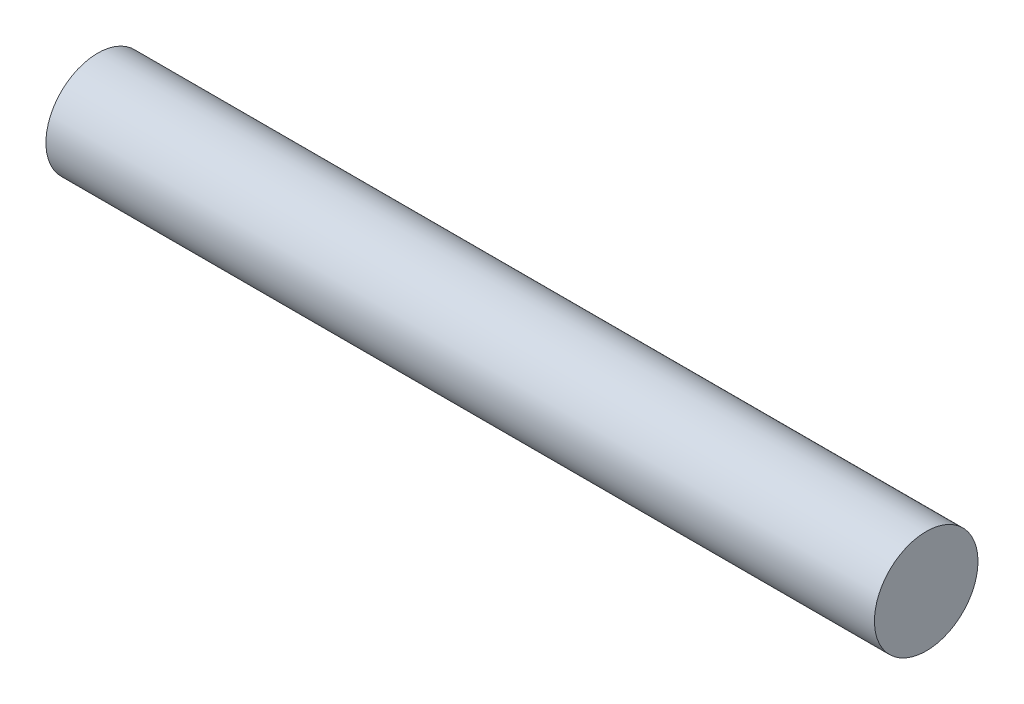
from build123d import *

# Parameters (mm, degrees)
SKETCH1_R           = 1
BOSS_EXTRUDE1_DEPTH = 16


with BuildPart() as part:
    # Sketch1 → Boss-Extrude1 (new body)
    with BuildSketch(Plane(origin=(0, 0, 0), x_dir=(0, 0, -1), z_dir=(1, 0, 0))):
        Circle(SKETCH1_R)
    extrude(amount=BOSS_EXTRUDE1_DEPTH)


solid = part.part
